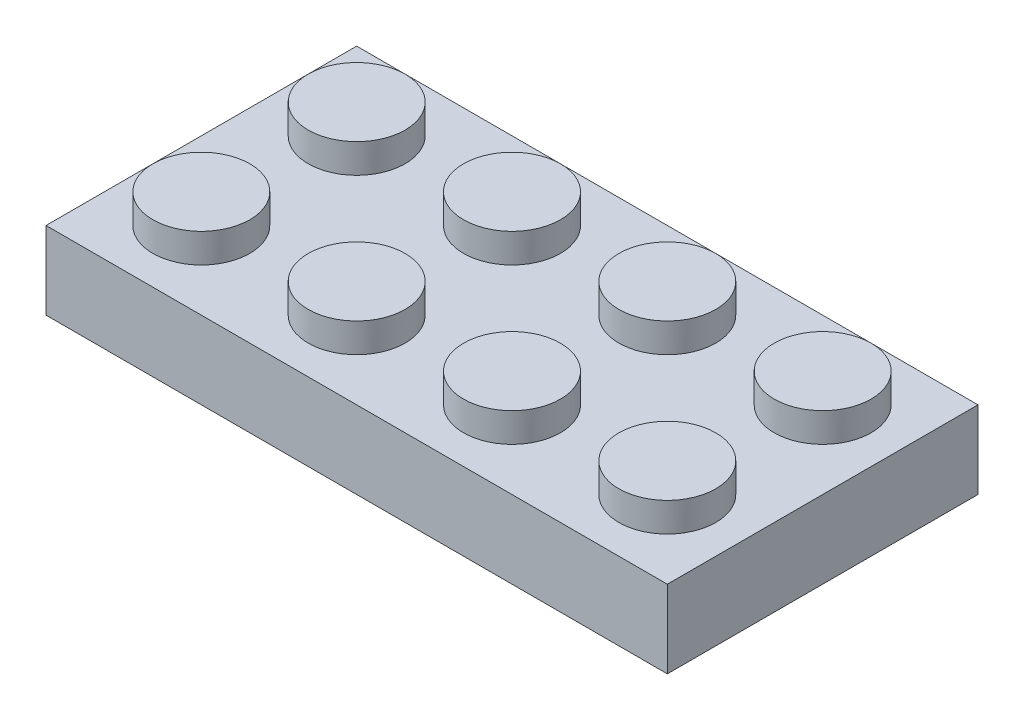
from build123d import *

# Parameters (mm, degrees)
SKETCH2_W            = 25.4
SKETCH2_H            = 12.7
BOSS_EXTRUDE1_DEPTH  = 3.175
SKETCH2_3_R          = 1.9812
BOSS_EXTRUDE2_DEPTH  = 1.1938
LPATTERN1_COUNT      = 4
LPATTERN1_PITCH      = 6.35
LPATTERN1_COUNT_DIR2 = 2
LPATTERN1_PITCH_DIR2 = 6.35
SHELL1_T             = -1.1938
SKETCH4_R            = 2.5019
SKETCH4_R_2          = 1.9812
BOSS_EXTRUDE3_DEPTH  = 1.9812
FILLET1_R            = 1.1938
FILLET2_R            = 1.1938
LPATTERN2_COUNT      = 3
LPATTERN2_PITCH      = 6.35


with BuildPart() as part:
    # Sketch2 → Boss-Extrude1 (new body)
    with BuildSketch(Plane(origin=(0, 0, 0), x_dir=(1, 0, 0), z_dir=(0, 1, 0))):
        with Locations((12.7, 6.35)):
            Rectangle(SKETCH2_W, SKETCH2_H)
    extrude(amount=-BOSS_EXTRUDE1_DEPTH)

    # Sketch2<3> → Boss-Extrude2 (add)
    with BuildSketch(Plane(origin=(0, 0, 0), x_dir=(1, 0, 0), z_dir=(0, 1, 0))):
        with Locations(Location((3.175, 9.525, 0), (0, 0, 90))):
            Circle(SKETCH2_3_R)
    boss_extrude2 = extrude(amount=BOSS_EXTRUDE2_DEPTH)

    # LPattern1: Boss-Extrude2 4 × 2
    with Locations(*[(i * LPATTERN1_PITCH, 0, j * LPATTERN1_PITCH_DIR2) for i in range(LPATTERN1_COUNT) for j in range(LPATTERN1_COUNT_DIR2) if (i, j) != (0, 0)]):
        add(boss_extrude2)

    # Shell1
    shell1_openings = [part.faces().sort_by_distance(p)[0] for p in [
        (12.7, -3.175, -6.35),
    ]]
    offset(amount=SHELL1_T, openings=shell1_openings, kind=Kind.INTERSECTION)

    # Sketch4 → Boss-Extrude3 (add)
    with BuildSketch(Plane.XZ.offset(1.1938)):
        with Locations(Location((6.35, -6.363913067, 0), (0, 0, 270))):
            Circle(SKETCH4_R)
        with Locations(Location((6.35, -6.363913067, 0), (0, 0, 270))):
            Circle(SKETCH4_R_2, mode=Mode.SUBTRACT)
    boss_extrude3 = extrude(amount=BOSS_EXTRUDE3_DEPTH)

    # Fillet1
    fillet1_edges = [part.edges().sort_by_distance(p)[0] for p in [
        (1.1938, -2.1844, -1.1938),
    ]]
    fillet(fillet1_edges, radius=FILLET1_R)

    # Fillet2
    fillet2_edges = [part.edges().sort_by_distance(p)[0] for p in [
        (1.1938, -2.1844, -11.5062),
        (24.2062, -2.1844, -11.5062),
        (24.2062, -2.1844, -1.1938),
    ]]
    fillet(fillet2_edges, radius=FILLET2_R)

    # LPattern2: Boss-Extrude3 ×3
    with Locations(*[(i * LPATTERN2_PITCH, 0, 0) for i in range(1, LPATTERN2_COUNT)]):
        add(boss_extrude3)


solid = part.part
